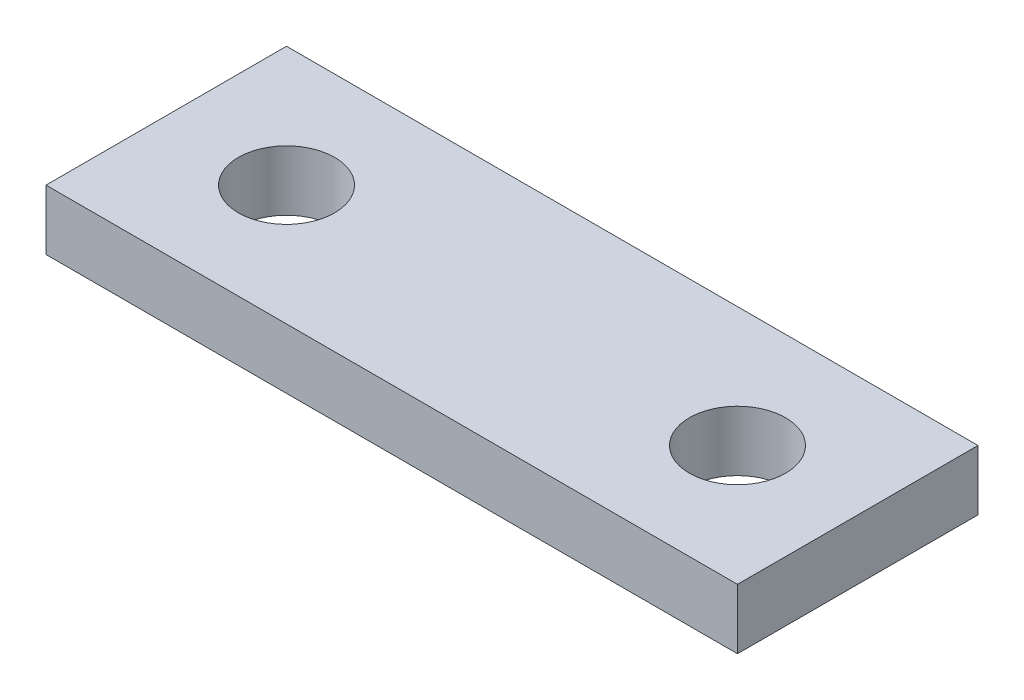
from build123d import *

# Parameters (mm, degrees)
SKETCH_1_W          = 23
SKETCH_1_H          = 8
EXTRUDE_1_DEPTH     = 2
SKETCH_2_R          = 1.6
CUT_EXTRUDE_1_DEPTH = 13.338962679


with BuildPart() as part:
    # 草图1 → 凸台-拉伸1 (new body)
    with BuildSketch(Plane(origin=(0, 0, 0), x_dir=(1, 0, 0), z_dir=(0, 1, 0))):
        Rectangle(SKETCH_1_W, SKETCH_1_H)
    extrude(amount=EXTRUDE_1_DEPTH)

    # 草图2 → 切除-拉伸1 (cut, through all)
    with BuildSketch(Plane(origin=(0, 2, 0), x_dir=(1, 0, 0), z_dir=(0, 1, 0))):
        with Locations(Location((-7.5, 0, 0), (0, 0, 270))):
            Circle(SKETCH_2_R)
        with Locations(Location((7.5, 0, 0), (0, 0, 270))):
            Circle(SKETCH_2_R)
    extrude(amount=-CUT_EXTRUDE_1_DEPTH, mode=Mode.SUBTRACT)


solid = part.part
